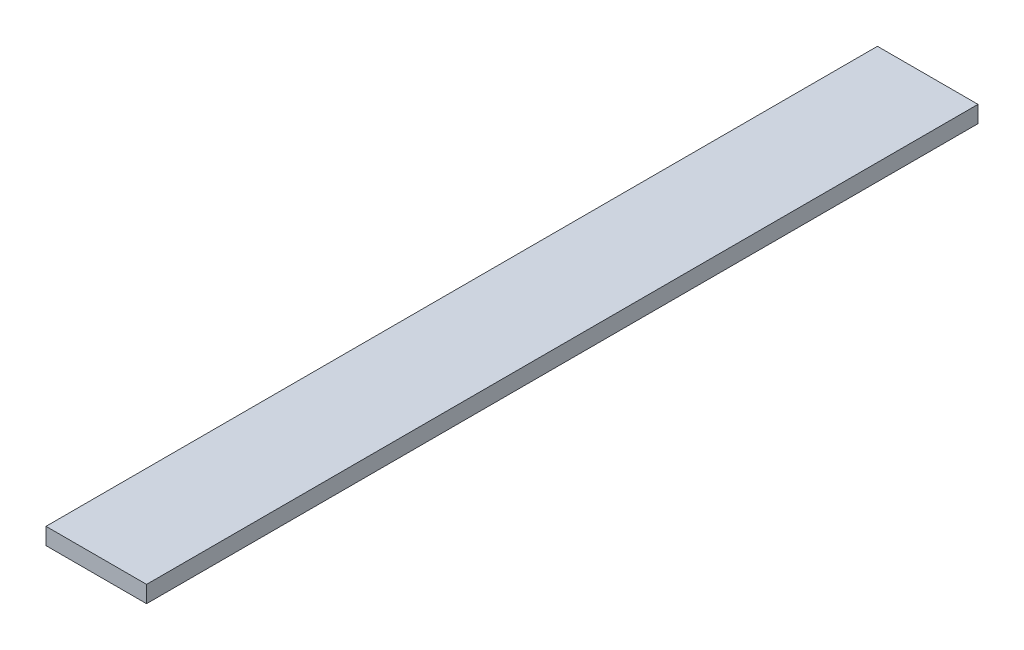
from build123d import *

# Parameters (mm, degrees)
SKETCH1_W           = 76.2
SKETCH1_H           = 12.7
BOSS_EXTRUDE1_DEPTH = 630


with BuildPart() as part:
    # Sketch1 → Boss-Extrude1 (new body)
    with BuildSketch(Plane.XY):
        Rectangle(SKETCH1_W, SKETCH1_H)
    extrude(amount=BOSS_EXTRUDE1_DEPTH)


solid = part.part
